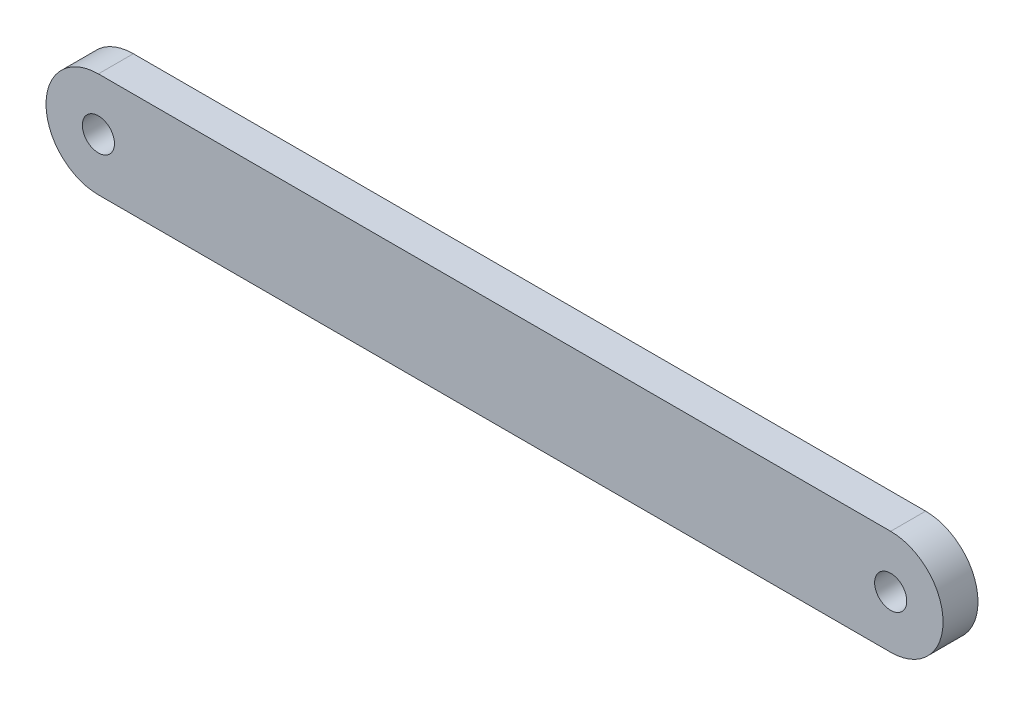
from build123d import *

# Parameters (mm, degrees)
SKETCH_1_R      = 2.3
EXTRUDE_1_DEPTH = 5


with BuildPart() as part:
    # 草图1 → 凸台-拉伸1 (new body)
    with BuildSketch(Plane.XY):
        with BuildLine():
            Line((-56.7, 7.5), (56.7, 7.5))
            ThreePointArc((56.7, 7.5), (64.2, 0), (56.7, -7.5))
            Line((56.7, -7.5), (-56.7, -7.5))
            ThreePointArc((-56.7, -7.5), (-64.2, 0), (-56.7, 7.5))
        make_face()
        with Locations((-56.7, 0)):
            Circle(SKETCH_1_R, mode=Mode.SUBTRACT)
        with Locations((56.7, 0)):
            Circle(SKETCH_1_R, mode=Mode.SUBTRACT)
    extrude(amount=EXTRUDE_1_DEPTH)


solid = part.part
